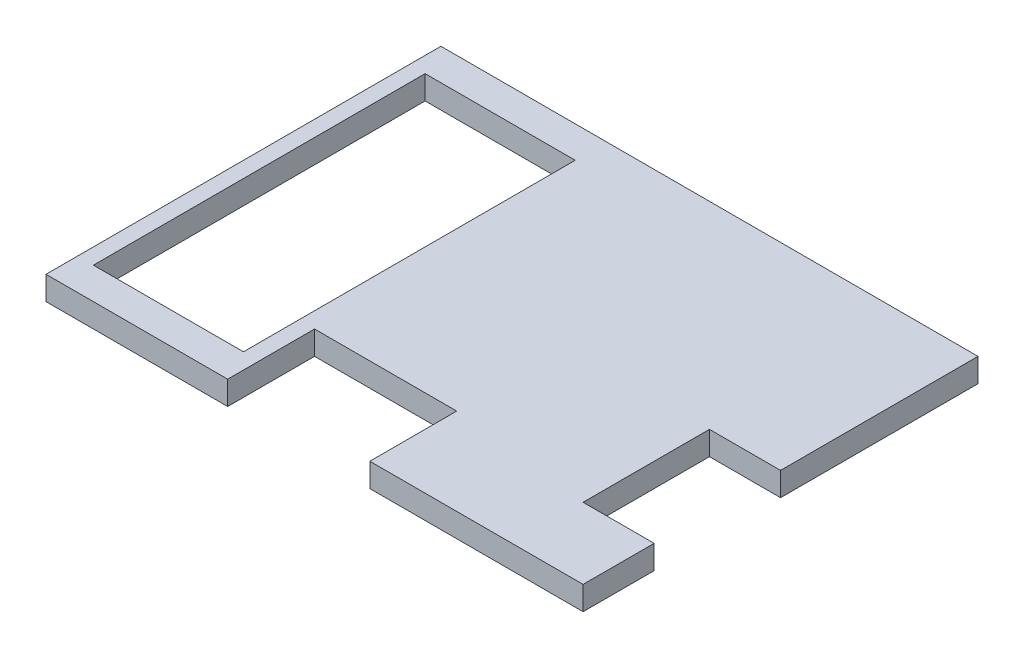
from build123d import *

# Parameters (mm, degrees)
SKETCH1_W           = 19
SKETCH1_H           = 42
BOSS_EXTRUDE1_DEPTH = 3


with BuildPart() as part:
    # Sketch1 → Boss-Extrude1 (new body)
    with BuildSketch(Plane(origin=(0, 0, 0), x_dir=(1, 0, 0), z_dir=(0, 1, 0))):
        Polygon((-34, -25), (-11, -25), (-11, -14), (7, -14), (7, -25), (34, -25), (34, -16), (25, -16), (25, 0), (34, 0), (34, 25), (-34, 25), align=None)
        with Locations((-22.5, 0)):
            Rectangle(SKETCH1_W, SKETCH1_H, mode=Mode.SUBTRACT)
    extrude(amount=BOSS_EXTRUDE1_DEPTH)


solid = part.part
